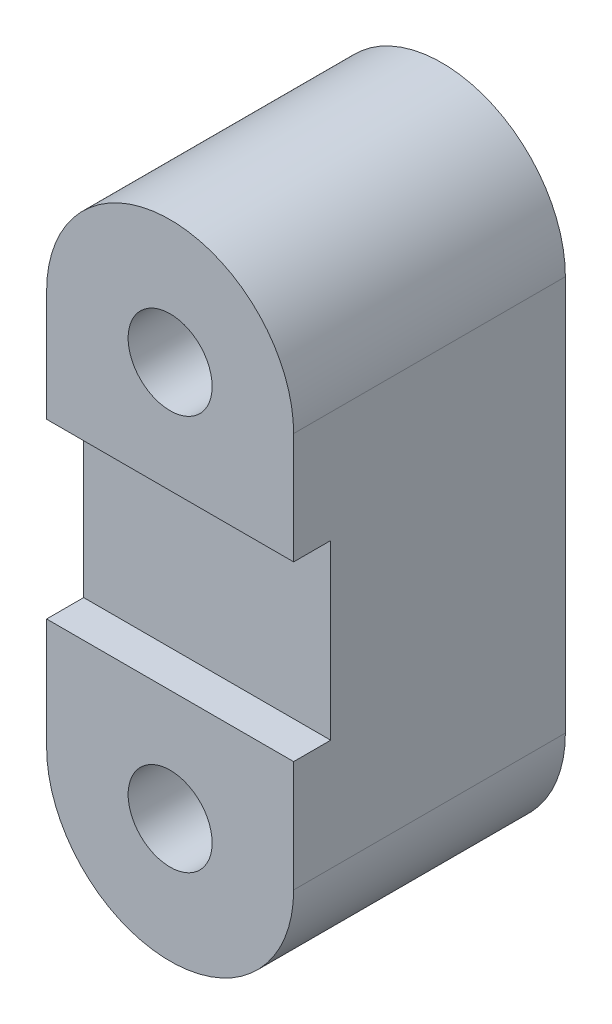
from build123d import *

# Parameters (mm, degrees)
SKETCH1_R           = 1.7
BOSS_EXTRUDE1_DEPTH = 11
SKETCH2_W           = 10
SKETCH2_H           = 7
CUT_EXTRUDE1_DEPTH  = 1.5


with BuildPart() as part:
    # Sketch1 → Boss-Extrude1 (new body)
    with BuildSketch(Plane.XY):
        with BuildLine():
            Line((-5, -8), (-5, 8))
            ThreePointArc((-5, 8), (0, 13), (5, 8))
            Line((5, 8), (5, -8))
            ThreePointArc((5, -8), (0, -13), (-5, -8))
        make_face()
        with Locations((0, 8)):
            Circle(SKETCH1_R, mode=Mode.SUBTRACT)
        with Locations((0, -8)):
            Circle(SKETCH1_R, mode=Mode.SUBTRACT)
    extrude(amount=BOSS_EXTRUDE1_DEPTH)

    # Sketch2 → Cut-Extrude1 (cut)
    with BuildSketch(Plane.XY.offset(11)):
        Rectangle(SKETCH2_W, SKETCH2_H)
    extrude(amount=-CUT_EXTRUDE1_DEPTH, mode=Mode.SUBTRACT)


solid = part.part
